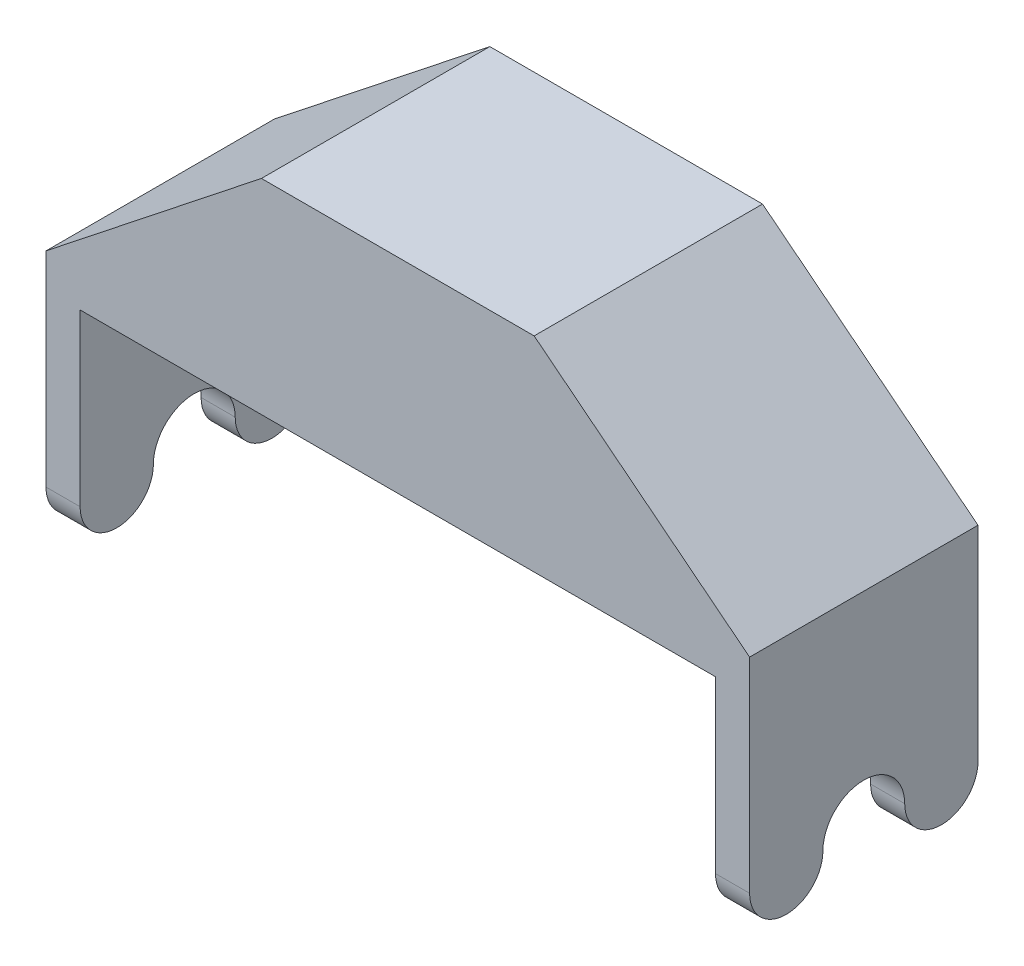
from build123d import *

# Parameters (mm, degrees)
EXTRUDE_1_DEPTH     = 33.5
SKETCH_6_R          = 6
CUT_EXTRUDE_2_DEPTH = 103.2
SKETCH_7_R          = 5.375
EXTRUDE_3_DEPTH     = 103.2
CUT_EXTRUDE_3_REACH = 84.471


with BuildPart() as part:
    # 草图1 → 凸台-拉伸1 (new body)
    with BuildSketch(Plane.XY):
        Polygon((51.6, -0.076277531), (51.6, 29.923722469), (20, 54.923722469), (-20, 54.923722469), (-51.6, 29.923722469), (-51.6, -0.076277531), align=None)
    extrude(amount=EXTRUDE_1_DEPTH)

    # 草图6 → 切除-拉伸2 (cut)
    with BuildSketch(Plane.ZY.offset(51.6)):
        with Locations((16.75, -0.076277531)):
            Circle(SKETCH_6_R)
    extrude(amount=-CUT_EXTRUDE_2_DEPTH, mode=Mode.SUBTRACT)

    # 草图7 → 凸台-拉伸3 (add)
    with BuildSketch(Plane.ZY.offset(51.6)):
        with Locations((5.375, -0.076277531)):
            Circle(SKETCH_7_R)
        with Locations((28.125, -0.076277531)):
            Circle(SKETCH_7_R)
    extrude(amount=-EXTRUDE_3_DEPTH)

    # 切除-拉伸3: up to this face of the body (flat: up to its plane)
    cut_extrude_3_end = Plane(part.part.faces().sort_by_distance((0, 24.324732157, 0))[0])
    # 草图8 → 切除-拉伸3 (cut, up to the picked face)
    with BuildSketch(Plane.XY.offset(33.5), mode=Mode.PRIVATE) as cut_extrude_3_sk1:
        Polygon((-46.6, -0.076277531), (-46.6, 24.923722469), (46.6, 24.923722469), (46.6, -0.076277531), (46.6, -12.111349377), (-46.6, -12.111349377), align=None)
    cut_extrude_3_tool1 = split(extrude(cut_extrude_3_sk1.sketch, amount=-CUT_EXTRUDE_3_REACH, mode=Mode.PRIVATE), bisect_by=cut_extrude_3_end, keep=Keep.BOTH, mode=Mode.PRIVATE)
    add(cut_extrude_3_tool1.solids().sort_by(Axis((0, 6.406187, 33.5), (0, 0, -1)))[0], mode=Mode.SUBTRACT)


solid = part.part
